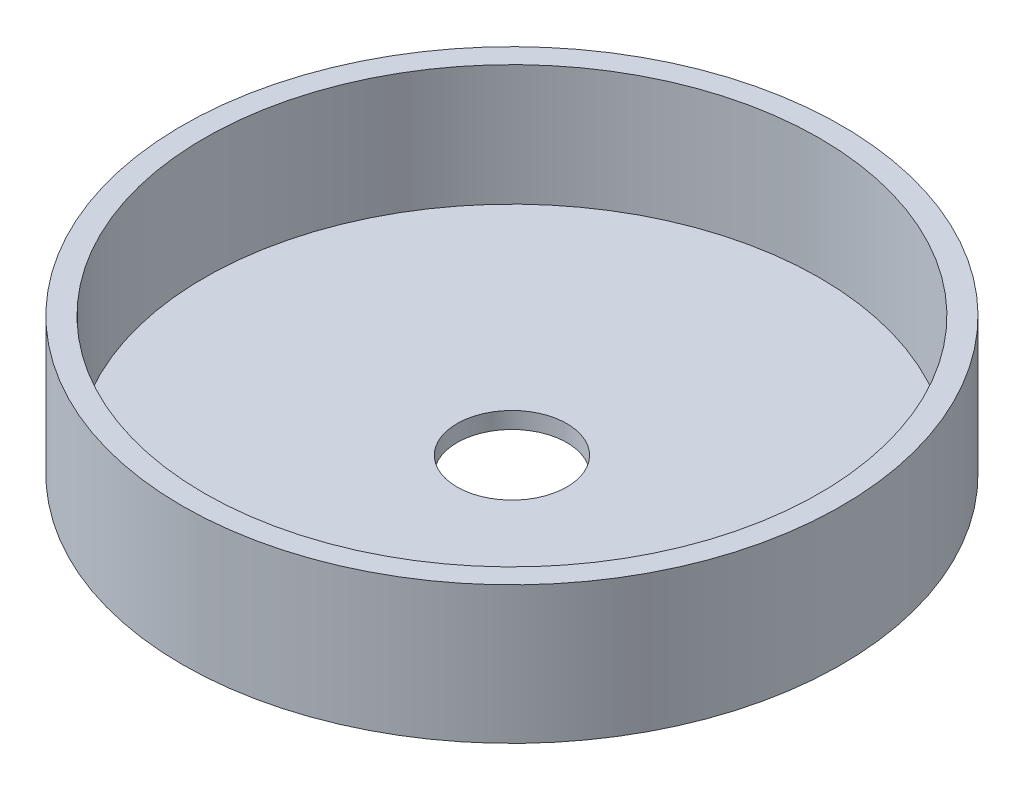
from build123d import *

# Parameters (mm, degrees)
PUCK_BASE_SKETCH_R   = 60
PUCK_BASE_SKETCH_R_2 = 10
PUCK_BASE_DEPTH      = 3
PUCK_WALL_SKETCH_R   = 60
PUCK_WALL_SKETCH_R_2 = 56
PUCK_WALL_DEPTH      = 25


with BuildPart() as part:
    # Puck Base Sketch → Puck Base (new body)
    with BuildSketch(Plane(origin=(0, 0, 0), x_dir=(1, 0, 0), z_dir=(0, 1, 0))):
        with Locations(Location((0, 0, 0), (0, 0, 270))):
            Circle(PUCK_BASE_SKETCH_R)
        with Locations(Location((0, 0, 0), (0, 0, 270))):
            Circle(PUCK_BASE_SKETCH_R_2, mode=Mode.SUBTRACT)
    extrude(amount=PUCK_BASE_DEPTH)

    # Puck Wall Sketch → Puck Wall (add)
    with BuildSketch(Plane(origin=(0, 0, 0), x_dir=(1, 0, 0), z_dir=(0, 1, 0))):
        with Locations(Location((0, 0, 0), (0, 0, 270))):
            Circle(PUCK_WALL_SKETCH_R)
        with Locations(Location((0, 0, 0), (0, 0, 270))):
            Circle(PUCK_WALL_SKETCH_R_2, mode=Mode.SUBTRACT)
    extrude(amount=PUCK_WALL_DEPTH)


solid = part.part
